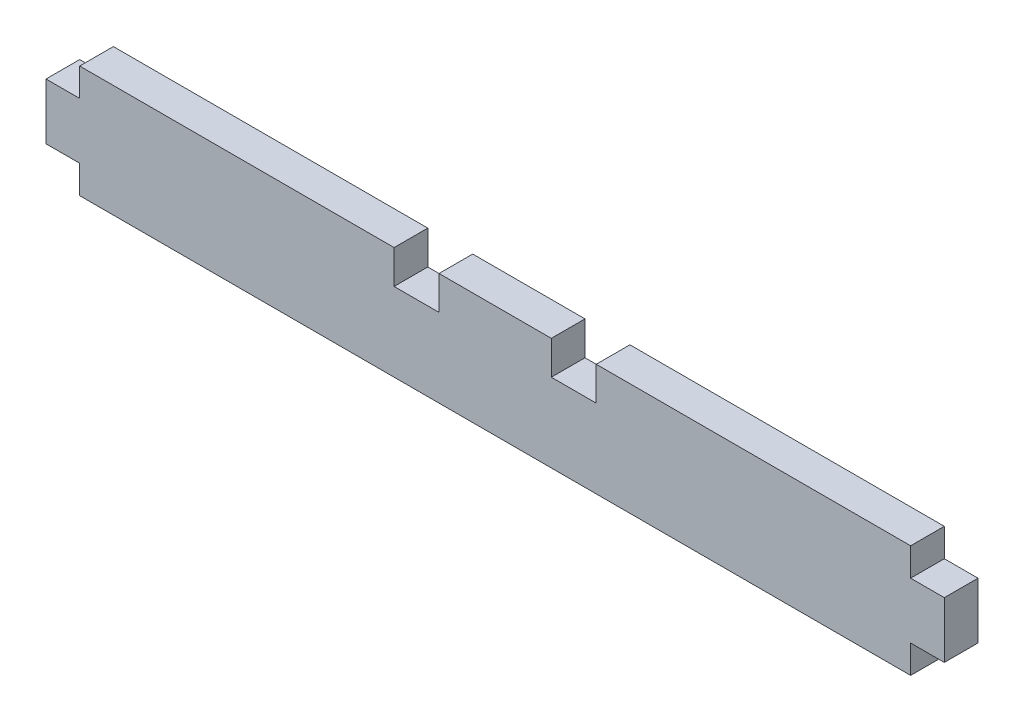
from build123d import *

# Parameters (mm, degrees)
SKETCH_1_W      = 74
SKETCH_1_H      = 7
SKETCH_1_W_2    = 10
SKETCH_1_H_2    = 3
SKETCH_1_W_3    = 3
SKETCH_1_H_3    = 5
EXTRUDE_1_DEPTH = 3


with BuildPart() as part:
    # 草圖1 → 填料-伸長1 (new body)
    with BuildSketch(Plane.XY):
        Polygon((-37, 4), (-37, 3.5), (-9, 3.5), (-9, 6.5), (-37, 6.5), align=None)
        Rectangle(SKETCH_1_W, SKETCH_1_H)
        with Locations((0, 5)):
            Rectangle(SKETCH_1_W_2, SKETCH_1_H_2)
        Polygon((9, 6.5), (9, 3.5), (37, 3.5), (37, 4), (37, 6.5), align=None)
        with Locations((-38.5, 1.5)):
            Rectangle(SKETCH_1_W_3, SKETCH_1_H_3)
        with Locations((38.5, 1.5)):
            Rectangle(SKETCH_1_W_3, SKETCH_1_H_3)
    extrude(amount=EXTRUDE_1_DEPTH)


solid = part.part
